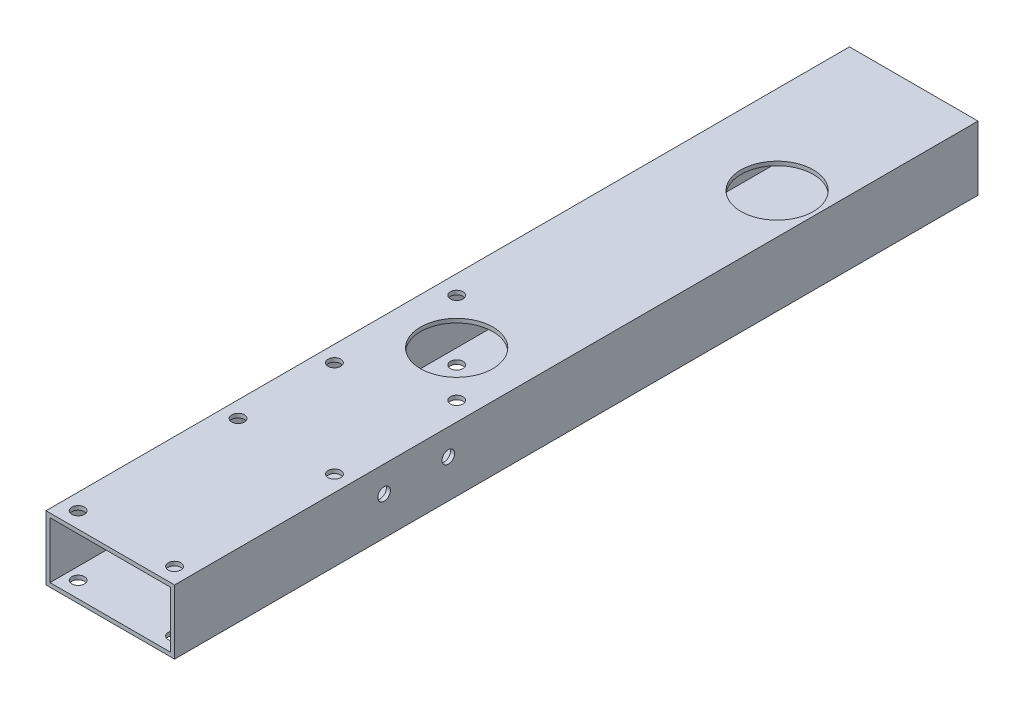
from build123d import *

# Parameters (mm, degrees)
BOSS_EXTRUDE1_DEPTH      = 158.750001
BOSS_EXTRUDE1_DEPTH_BACK = 158.750001
SKETCH3_W                = 50.8
SKETCH3_H                = 25.4
SKETCH3_W_2              = 47.625
SKETCH3_H_2              = 22.225
SKETCH4_R                = 14.2875
CUT_EXTRUDE1_DEPTH       = 39.37
F_10_CLEARANCE_HOLE1_D   = 4.9784
F_10_CLEARANCE_HOLE2_D   = 4.9784
F_10_CLEARANCE_HOLE3_D   = 4.9784


with BuildPart() as part:
    # Sketch3 → Boss-Extrude1 (new, two sides: drawn at the far end of the back side and taken through both)
    with BuildSketch(Plane.XY.offset(-BOSS_EXTRUDE1_DEPTH_BACK)):
        Rectangle(SKETCH3_W, SKETCH3_H)
        Rectangle(SKETCH3_W_2, SKETCH3_H_2, mode=Mode.SUBTRACT)
    extrude(amount=BOSS_EXTRUDE1_DEPTH + BOSS_EXTRUDE1_DEPTH_BACK)

    # Sketch4 → Cut-Extrude1 (cut)
    with BuildSketch(Plane(origin=(0, 12.7, 0), x_dir=(1, 0, 0), z_dir=(0, 1, 0))):
        with Locations(Location((9.525, 95.250000508, 0), (0, 0, 180))):
            Circle(SKETCH4_R)
        with Locations(Location((0, -21.863697987, 0), (0, 0, 180))):
            Circle(SKETCH4_R)
    extrude(amount=-CUT_EXTRUDE1_DEPTH, mode=Mode.SUBTRACT)

    # #10 Clearance Hole1 (through all)
    with Locations(Plane(origin=(0, 12.7, 0), x_dir=(1, 0, 0), z_dir=(0, 1, 0))):
        with Locations((-17.960512242, -3.903185745), (17.960512242, -39.824210229)):
            Hole(F_10_CLEARANCE_HOLE1_D / 2)

    # #10 Clearance Hole2 (through all)
    with Locations(Plane.ZY.offset(25.4)):
        with Locations((50.549668409, 2.425), (75.949668409, 2.425)):
            Hole(F_10_CLEARANCE_HOLE2_D / 2)

    # #10 Clearance Hole3 (through all)
    with Locations(Plane(origin=(0, 12.7, 0), x_dir=(1, 0, 0), z_dir=(0, 1, 0))):
        with Locations((-19.05, -51.113080493), (-19.05, -89.213080493), (19.05, -89.213080493), (19.05, -152.400000508), (-19.05, -152.400000508)):
            Hole(F_10_CLEARANCE_HOLE3_D / 2)


solid = part.part
